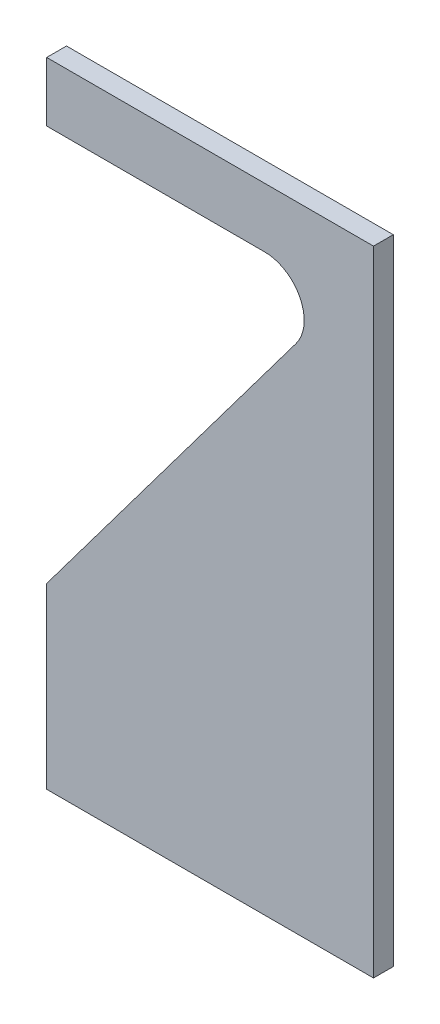
from build123d import *

# Parameters (mm, degrees)
EXTRUDE_1_DEPTH = 10


with BuildPart() as part:
    # 草图6 → 凸台-拉伸1 (new body)
    with BuildSketch(Plane.XY):
        with BuildLine():
            Line((0, 0), (0, -320))
            Line((0, -320), (-165, -320))
            Line((-165, -320), (-165, -230))
            Line((-165, -230), (-38.999552502, -62.000028583))
            ThreePointArc((-38.999552502, -62.000028583), (-37.110979256, -41.055744068), (-54.999531065, -30))
            Line((-54.999531065, -30), (-165, -30))
            Line((-165, -30), (-165, 0))
            Line((-165, 0), (0, 0))
        make_face()
    extrude(amount=EXTRUDE_1_DEPTH)


solid = part.part
